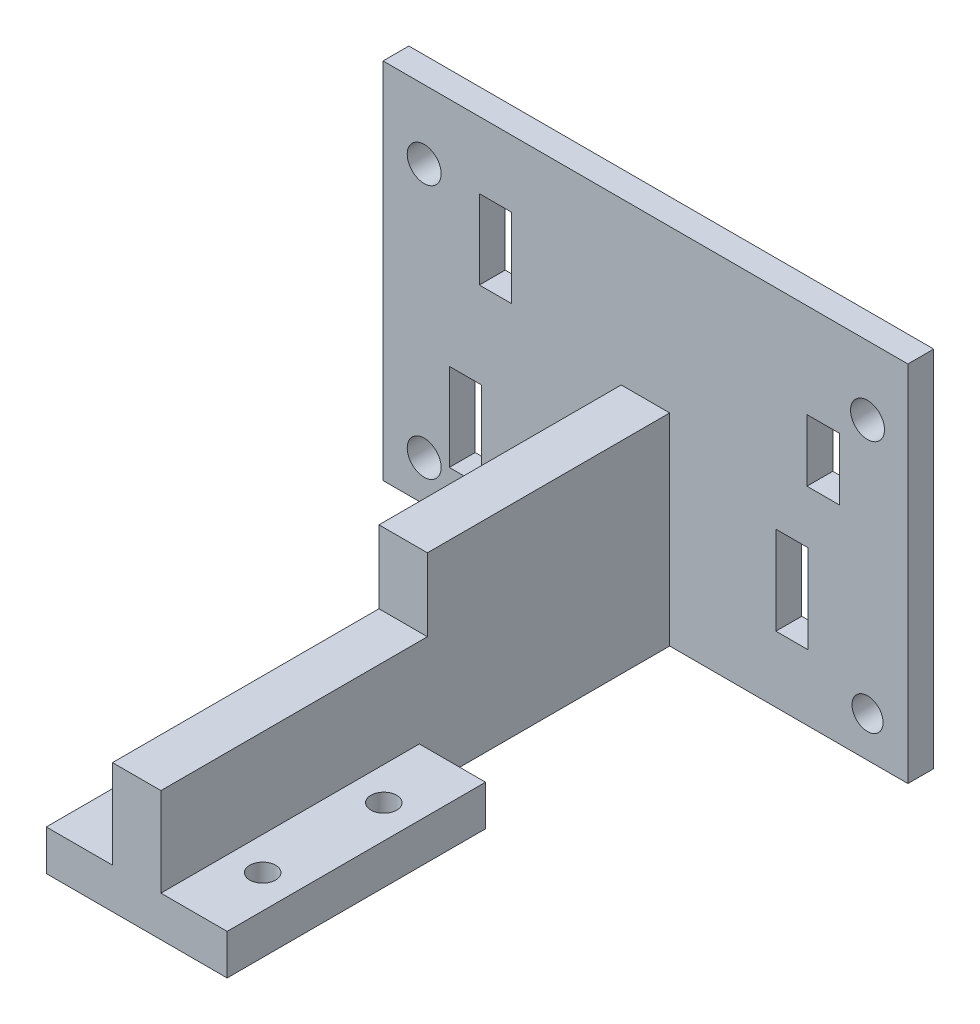
from build123d import *

# Parameters (mm, degrees)
SKETCH_1_W          = 8.2
SKETCH_1_H          = 32
SKETCH_1_R          = 1.6
EXTRUDE_1_DEPTH     = 5
SKETCH_2_W          = 6
SKETCH_2_H          = 63
EXTRUDE_2_DEPTH     = 25
SKETCH_3_W          = 65
SKETCH_3_H          = 45
EXTRUDE_3_DEPTH     = 3.2
SKETCH_4_R          = 1.922469011
SKETCH_4_R_2        = 2.1
CUT_EXTRUDE_1_DEPTH = 13.2
SKETCH_7_W          = 4
SKETCH_7_H          = 7.68275579
SKETCH_7_H_2        = 10.940540448
SKETCH_7_H_3        = 9.798767364
SKETCH_7_H_4        = 10.843668011
CUT_EXTRUDE_2_DEPTH = 13.2
SKETCH_8_W          = 33
SKETCH_8_H          = 9
CUT_EXTRUDE_3_DEPTH = 13.2


with BuildPart() as part:
    # 草图1 → 凸台-拉伸1 (new body)
    with BuildSketch(Plane(origin=(0, 0, 0), x_dir=(1, 0, 0), z_dir=(0, 1, 0))):
        Rectangle(SKETCH_1_W, SKETCH_1_H)
        with Locations(Location((0, 7.5, 0), (0, 0, 270))):
            Circle(SKETCH_1_R, mode=Mode.SUBTRACT)
        with Locations(Location((0, -7.5, 0), (0, 0, 90))):
            Circle(SKETCH_1_R, mode=Mode.SUBTRACT)
    extrude_1 = extrude(amount=EXTRUDE_1_DEPTH)

    # 草图2 → 凸台-拉伸2 (add)
    with BuildSketch(Plane(origin=(0, 0, 0), x_dir=(1, 0, 0), z_dir=(0, 1, 0))):
        with Locations((7.1, 15.5)):
            Rectangle(SKETCH_2_W, SKETCH_2_H)
    extrude(amount=EXTRUDE_2_DEPTH)

    # 草图3 → 凸台-拉伸3 (add)
    with BuildSketch(Plane(origin=(0, 0, -47), x_dir=(-1, 0, 0), z_dir=(0, 0, -1))):
        with Locations((-7.1, 22.5)):
            Rectangle(SKETCH_3_W, SKETCH_3_H)
    extrude(amount=EXTRUDE_3_DEPTH)

    # 草图4 → 切除-拉伸1 (cut)
    with BuildSketch(Plane(origin=(0, 0, -50.2), x_dir=(-1, 0, 0), z_dir=(0, 0, -1))):
        with Locations((-34.6, 5)):
            Circle(SKETCH_4_R)
        with Locations((20.3, 5)):
            Circle(SKETCH_4_R_2)
        with Locations((-34.6, 36.5)):
            Circle(SKETCH_4_R_2)
        with Locations((20.3, 36.5)):
            Circle(SKETCH_4_R_2)
    extrude(amount=-CUT_EXTRUDE_1_DEPTH, mode=Mode.SUBTRACT)

    # 草图7 → 切除-拉伸2 (cut)
    with BuildSketch(Plane(origin=(0, 0, -50.2), x_dir=(-1, 0, 0), z_dir=(0, 0, -1))):
        with Locations((-29.100303776, 29.48244197)):
            Rectangle(SKETCH_7_W, SKETCH_7_H)
        with Locations((-25.252299823, 13.640004416)):
            Rectangle(SKETCH_7_W, SKETCH_7_H_2)
        with Locations((11.465466314, 31.834080816)):
            Rectangle(SKETCH_7_W, SKETCH_7_H_3)
        with Locations((15.188894487, 10.930624409)):
            Rectangle(SKETCH_7_W, SKETCH_7_H_4)
    extrude(amount=-CUT_EXTRUDE_2_DEPTH, mode=Mode.SUBTRACT)

    # 镜向1: 凸台-拉伸1 across plane
    add(extrude_1.mirror(Plane.ZY.offset(-7.1)))

    # 草图8 → 切除-拉伸3 (cut)
    with BuildSketch(Plane.ZY.offset(-4.1)):
        with Locations((-0.5, 20.5)):
            Rectangle(SKETCH_8_W, SKETCH_8_H)
    extrude(amount=-CUT_EXTRUDE_3_DEPTH, mode=Mode.SUBTRACT)


solid = part.part
